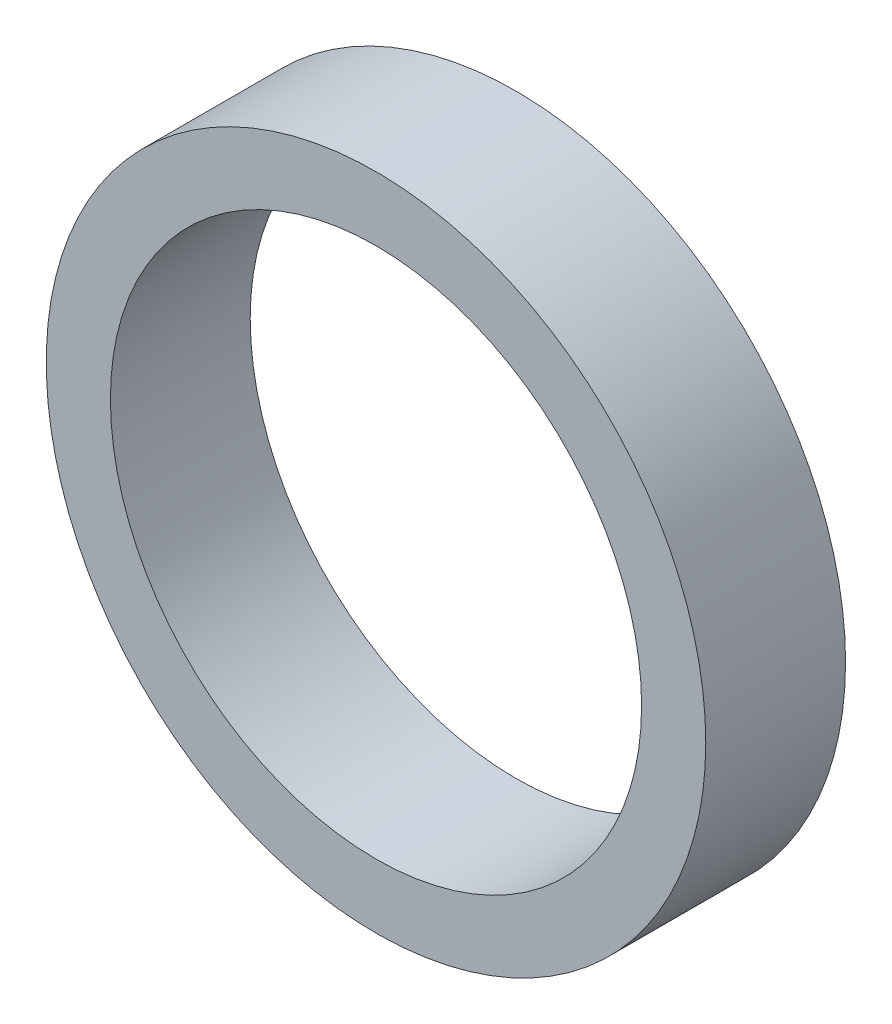
from build123d import *

# Parameters (mm, degrees)
SKETCH1_R           = 23.59
SKETCH1_R_2         = 19
BOSS_EXTRUDE1_DEPTH = 10


with BuildPart() as part:
    # Sketch1 → Boss-Extrude1 (new body)
    with BuildSketch(Plane.XY):
        Circle(SKETCH1_R)
        Circle(SKETCH1_R_2, mode=Mode.SUBTRACT)
    extrude(amount=BOSS_EXTRUDE1_DEPTH)


solid = part.part
